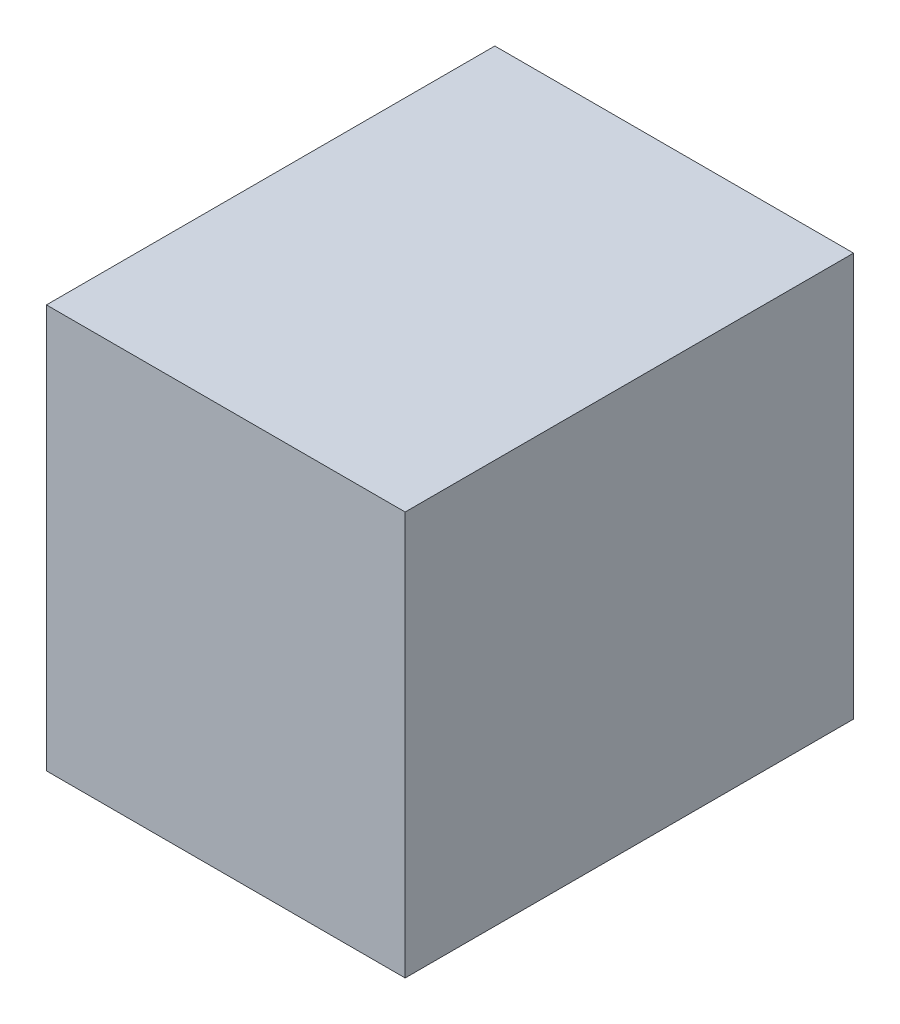
from build123d import *

# Parameters (mm, degrees)
SKETCH_1_W      = 400
SKETCH_1_H      = 450
EXTRUDE_1_DEPTH = 500


with BuildPart() as part:
    # ｽｹｯﾁ1 → ﾎﾞｽ - 押し出し1 (new body)
    with BuildSketch(Plane.XY):
        with Locations((200, 225)):
            Rectangle(SKETCH_1_W, SKETCH_1_H)
    extrude(amount=EXTRUDE_1_DEPTH)


solid = part.part
